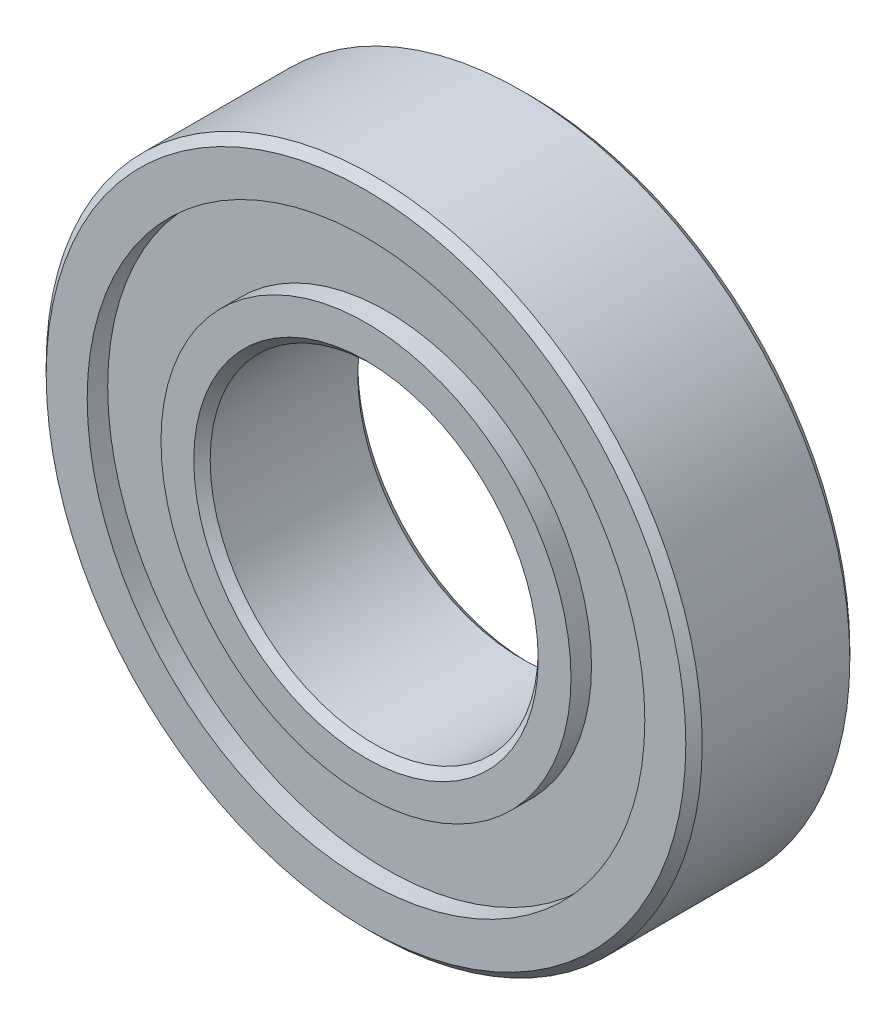
from build123d import *

# Parameters (mm, degrees)
FASE1_SIZE = 0.1


with BuildPart() as part:
    # Skizze2 → Rotation1 (revolve)
    with BuildSketch(Plane(origin=(0, 0, 0), x_dir=(0, 0, -1), z_dir=(1, 0, 0))):
        Polygon((-1, 2), (1, 2), (1, 2.5), (0.75, 2.5), (0.75, 3.4), (1, 3.4), (1, 4), (-1, 4), (-1, 3.4), (-0.75, 3.4), (-0.75, 2.5), (-1, 2.5), align=None)
    revolve(axis=Axis((0, 0, 11.845846522), (0, 0, -1)))

    # Fase1
    fase1_edges = [part.edges().sort_by_distance(p)[0] for p in [
        (0, -2, -1),
        (0, -2, 1),
        (0, -4, -1),
        (0, -4, 1),
    ]]
    chamfer(fase1_edges, length=FASE1_SIZE)


solid = part.part
